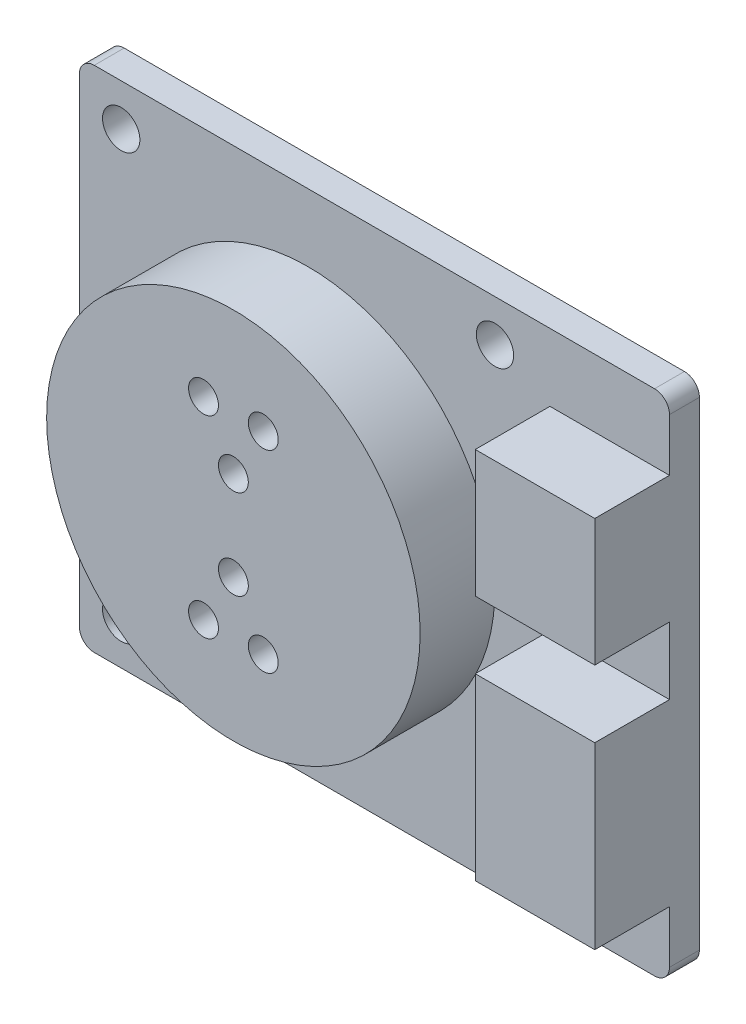
from build123d import *

# Parameters (mm, degrees)
SKETCH_1_W          = 39.5
SKETCH_1_H          = 34.04
EXTRUDE_1_DEPTH     = 2
SKETCH_2_R          = 1.25
CUT_EXTRUDE_1_DEPTH = 2
SKETCH_3_R          = 12.5
EXTRUDE_2_DEPTH     = 5
FILLET_1_R          = 1
SKETCH_4_W          = 8
SKETCH_4_H          = 8.5
SKETCH_4_H_2        = 12
EXTRUDE_3_DEPTH     = 5
SKETCH_5_R          = 1
CUT_EXTRUDE_2_DEPTH = 5


with BuildPart() as part:
    # 草图1 → 凸台-拉伸1 (new body)
    with BuildSketch(Plane.XY):
        Rectangle(SKETCH_1_W, SKETCH_1_H)
    extrude(amount=EXTRUDE_1_DEPTH)

    # 草图2 → 切除-拉伸1 (cut)
    with BuildSketch(Plane.XY.offset(2)):
        with Locations((-16.95, 14.225)):
            Circle(SKETCH_2_R)
        with Locations((-16.95, -14.225)):
            Circle(SKETCH_2_R)
        with Locations((8.07, 14.225)):
            Circle(SKETCH_2_R)
        with Locations((8.07, -14.225)):
            Circle(SKETCH_2_R)
    extrude(amount=-CUT_EXTRUDE_1_DEPTH, mode=Mode.SUBTRACT)

    # 草图3 → 凸台-拉伸2 (add)
    with BuildSketch(Plane.XY.offset(2)):
        with Locations(Location((-4.44, 0, 0), (0, 0, 180))):
            Circle(SKETCH_3_R)
    extrude(amount=EXTRUDE_2_DEPTH)

    # 圆角1
    fillet_1_edges = [part.edges().sort_by_distance(p)[0] for p in [
        (19.75, -17.02, 1),
        (-19.75, -17.02, 1),
        (-19.75, 17.02, 1),
        (19.75, 17.02, 1),
    ]]
    fillet(fillet_1_edges, radius=FILLET_1_R)

    # 草图4 → 凸台-拉伸3 (add)
    with BuildSketch(Plane.XY.offset(2)):
        with Locations((15.75, 8.25)):
            Rectangle(SKETCH_4_W, SKETCH_4_H)
        with Locations((15.75, -6.5)):
            Rectangle(SKETCH_4_W, SKETCH_4_H_2)
    extrude(amount=EXTRUDE_3_DEPTH)

    # 草图5 → 切除-拉伸2 (cut)
    with BuildSketch(Plane.XY.offset(7)):
        with Locations((-6.44, 6.464101615)):
            Circle(SKETCH_5_R)
        with Locations((-2.44, 6.464101615)):
            Circle(SKETCH_5_R)
        with Locations((-4.44, 3)):
            Circle(SKETCH_5_R)
        with Locations(Location((-4.44, -3, 0), (0, 0, 180))):
            Circle(SKETCH_5_R)
        with Locations(Location((-2.44, -6.464101615, 0), (0, 0, 180))):
            Circle(SKETCH_5_R)
        with Locations(Location((-6.44, -6.464101615, 0), (0, 0, 180))):
            Circle(SKETCH_5_R)
    extrude(amount=-CUT_EXTRUDE_2_DEPTH, mode=Mode.SUBTRACT)


solid = part.part
